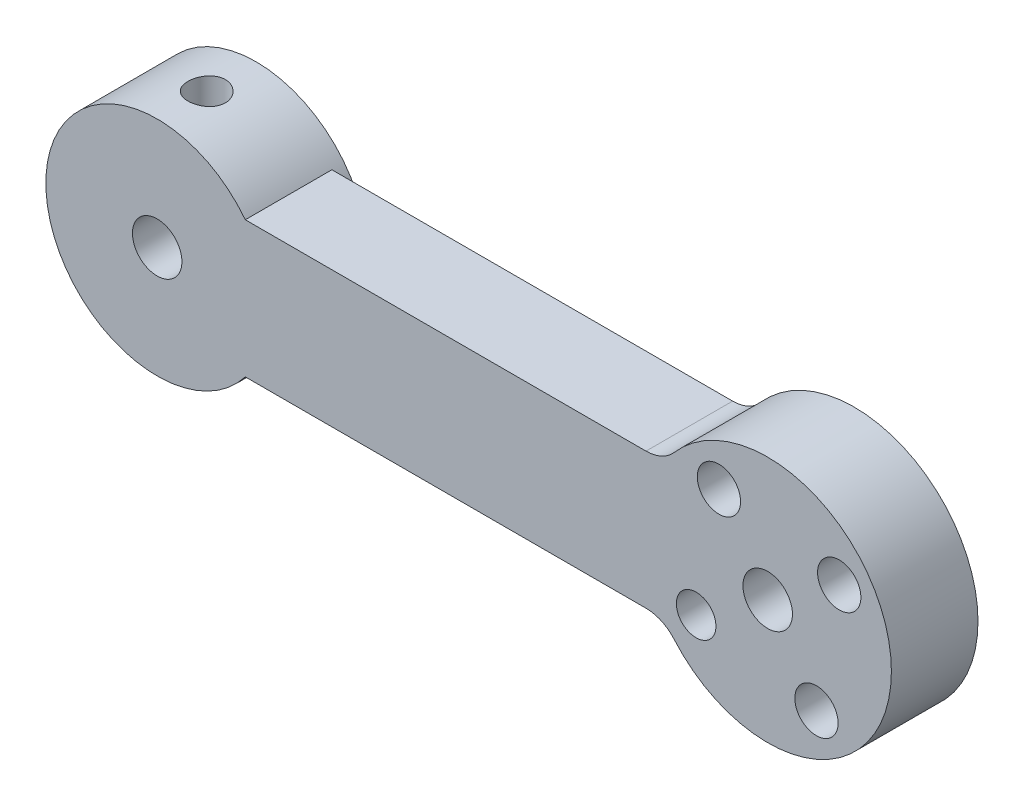
from build123d import *

# Parameters (mm, degrees)
BOSS_EXTRUDE1_DEPTH      = 7
SKETCH2_R                = 2
CUT_EXTRUDE1_DEPTH       = 66.594825405
FILLET11_R               = 3
SKETCH32_R               = 2
CUT_EXTRUDE14_DEPTH      = 66.594825405
SKETCH33_R               = 9
SKETCH33_R_2             = 2
BOSS_EXTRUDE2_DEPTH      = 8
SKETCH35_R               = 1.6
SKETCH35_R_2             = 1.75
CUT_EXTRUDE15_DEPTH      = 66.594825405
CUT_EXTRUDE16_DEPTH      = 65.51690569
CUT_EXTRUDE16_DEPTH_BACK = 65.51690569
SKETCH37_R               = 1.51


with BuildPart() as part:
    # Sketch1 → Boss-Extrude1 (new body)
    with BuildSketch(Plane.XY):
        with BuildLine():
            Line((0, 11), (0, 0))
            Line((0, 0), (45, 0))
            ThreePointArc((45, 0), (63.351646544, 5.5), (45, 11))
            Line((45, 11), (0, 11))
        make_face()
    extrude(amount=BOSS_EXTRUDE1_DEPTH)

    # Sketch2 → Cut-Extrude1 (cut, through all)
    with BuildSketch(Plane.XY.offset(7)):
        with Locations((53.351646544, 5.5)):
            Circle(SKETCH2_R)
        with Locations((-8.351646544, 5.5)):
            Circle(SKETCH2_R)
    extrude(amount=-CUT_EXTRUDE1_DEPTH, mode=Mode.SUBTRACT)

    # Fillet11
    fillet11_edges = [part.edges().sort_by_distance(p)[0] for p in [
        (45, 11, 3.5),
        (45, 0, 3.5),
    ]]
    fillet(fillet11_edges, radius=FILLET11_R)

    # Sketch32 → Cut-Extrude14 (cut, through all)
    with BuildSketch(Plane.XY.offset(7)):
        with Locations((4, 5.5)):
            Circle(SKETCH32_R)
    extrude(amount=-CUT_EXTRUDE14_DEPTH, mode=Mode.SUBTRACT)

    # Sketch33 → Boss-Extrude2 (add)
    with BuildSketch(Plane.XY.offset(7)):
        with Locations((4, 5.5)):
            Circle(SKETCH33_R)
        with Locations((4, 5.5)):
            Circle(SKETCH33_R_2, mode=Mode.SUBTRACT)
    extrude(amount=-BOSS_EXTRUDE2_DEPTH)

    # Sketch35 → Cut-Extrude15 (cut, through all)
    with BuildSketch(Plane(origin=(0, 0, 0), x_dir=(-1, 0, 0), z_dir=(0, 0, -1))):
        with Locations((-47.567725348, 1.557125972)):
            Circle(SKETCH35_R)
        with Locations((-57.294520572, -0.283921196)):
            Circle(SKETCH35_R_2)
        with Locations((-59.13556774, 9.442874028)):
            Circle(SKETCH35_R_2)
        with Locations((-49.408772516, 11.283921196)):
            Circle(SKETCH35_R_2)
    extrude(amount=-CUT_EXTRUDE15_DEPTH, mode=Mode.SUBTRACT)

    # Sketch37 → Cut-Extrude16 (cut, two sides: drawn at the far end of the back side and taken through both)
    with BuildSketch(Plane(origin=(0, 5.5, 0), x_dir=(1, 0, 0), z_dir=(0, 1, 0)).offset(-CUT_EXTRUDE16_DEPTH_BACK)):
        with Locations(Location((4, -3, 0), (0, 0, 270))):
            Circle(SKETCH37_R)
    extrude(amount=CUT_EXTRUDE16_DEPTH + CUT_EXTRUDE16_DEPTH_BACK, mode=Mode.SUBTRACT)


solid = part.part
